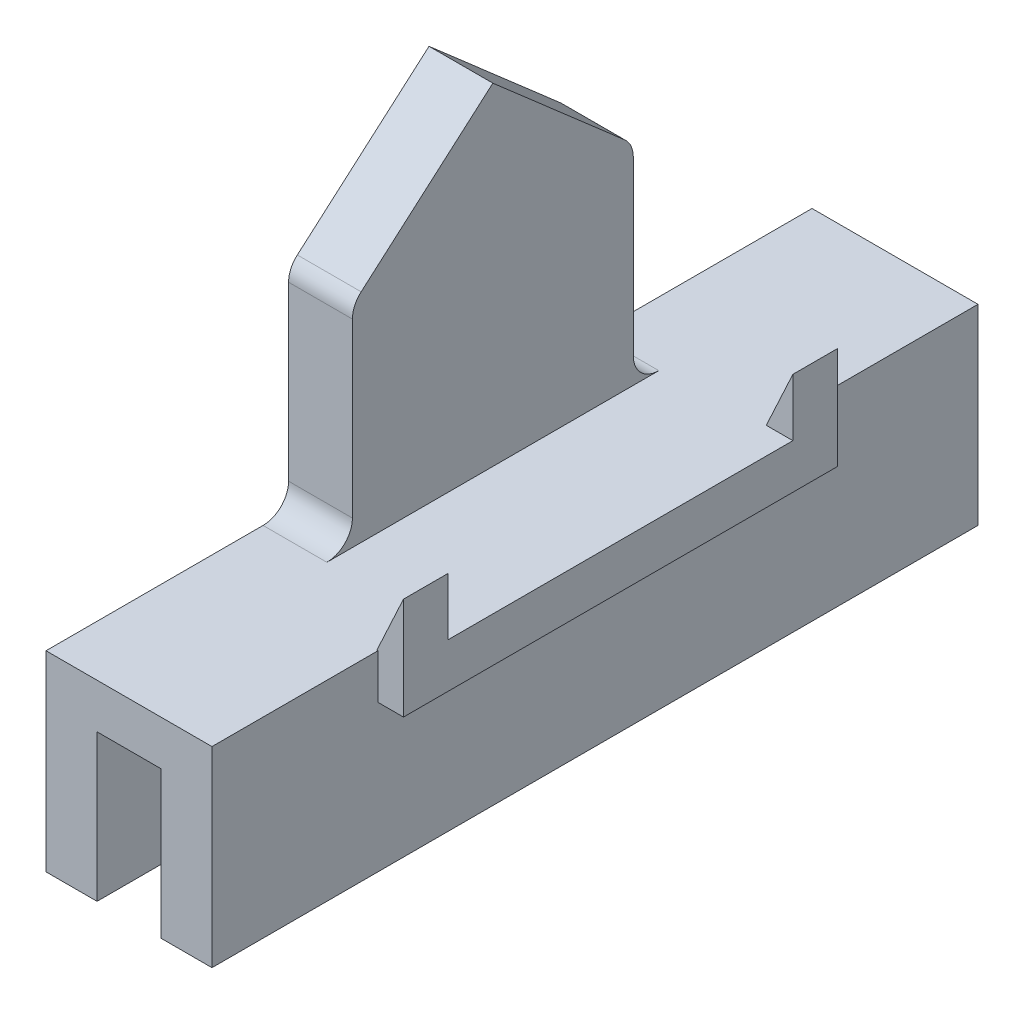
from build123d import *

# Parameters (mm, degrees)
EXTRUDE_1_DEPTH = 60
EXTRUDE_2_DEPTH = 5
SKETCH_3_W      = 34
SKETCH_3_H      = 3.5
EXTRUDE_3_DEPTH = 2
EXTRUDE_4_DEPTH = 3.5
FILLET_1_R      = 2
FILLET_2_R      = 2
FILLET_3_R      = 2
FILLET_4_R      = 2


with BuildPart() as part:
    # 草图1 → 凸台-拉伸1 (new body)
    with BuildSketch(Plane.XY):
        Polygon((-6.5, -7.5), (-2.5, -7.5), (-2.5, 4), (2.5, 4), (2.5, -7.5), (6.5, -7.5), (6.5, 7.5), (-6.5, 7.5), align=None)
    extrude(amount=EXTRUDE_1_DEPTH)

    # 草图2 → 凸台-拉伸2 (add)
    with BuildSketch(Plane.ZY.offset(6.5)):
        Polygon((19, 7.5), (41, 7.5), (41, 23.906923686), (30, 33.5), (19, 23.906923686), align=None)
    extrude(amount=-EXTRUDE_2_DEPTH)

    # 草图3 → 凸台-拉伸3 (add)
    with BuildSketch(Plane(origin=(6.5, 0, 0), x_dir=(0, 0, -1), z_dir=(1, 0, 0))):
        with Locations((-30, 5.75)):
            Rectangle(SKETCH_3_W, SKETCH_3_H)
    extrude(amount=EXTRUDE_3_DEPTH)

    # 草图4 → 凸台-拉伸4 (add)
    with BuildSketch(Plane.XY.offset(47)):
        Polygon((8.5, 4), (8.5, 12), (4.795643232, 4), align=None)
    extrude_4 = extrude(amount=-EXTRUDE_4_DEPTH)

    # 镜向1: 凸台-拉伸4 across plane
    add(extrude_4.mirror(Plane.XY.offset(30)))

    # 圆角1
    fillet_1_edges = [part.edges().sort_by_distance(p)[0] for p in [
        (-4, 7.5, 41),
    ]]
    fillet(fillet_1_edges, radius=FILLET_1_R)

    # 圆角2
    fillet_2_edges = [part.edges().sort_by_distance(p)[0] for p in [
        (-4, 7.5, 19),
    ]]
    fillet(fillet_2_edges, radius=FILLET_2_R)

    # 圆角3
    fillet_3_edges = [part.edges().sort_by_distance(p)[0] for p in [
        (-4, 23.906923686, 19),
    ]]
    fillet(fillet_3_edges, radius=FILLET_3_R)

    # 圆角4
    fillet_4_edges = [part.edges().sort_by_distance(p)[0] for p in [
        (-4, 23.906923686, 41),
    ]]
    fillet(fillet_4_edges, radius=FILLET_4_R)


solid = part.part
